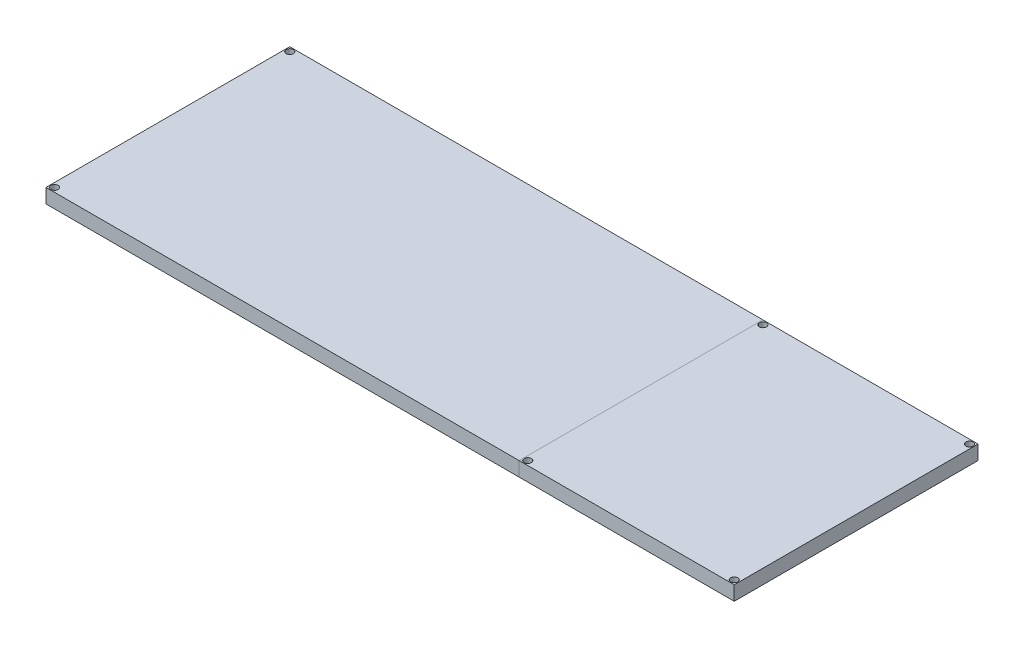
from build123d import *

# Parameters (mm, degrees)
IZIM1_W                     = 75
IZIM1_H                     = 85
Y_KSEKLIK_EKSTR_ZYON1_DEPTH = 5
IZIM2_W                     = 85
IZIM2_H                     = 5
Y_KSEKLIK_EKSTR_ZYON3_DEPTH = 165
IZIM3_R                     = 1.25
KES_EKSTR_ZYON1_DEPTH       = 186.674446276
IZIM4_R                     = 1.25
KES_EKSTR_ZYON2_DEPTH       = 186.674446276


with BuildPart() as part:
    # Çizim1 → Yükseklik-Ekstrüzyon1 (new body)
    with BuildSketch(Plane(origin=(0, 0, 0), x_dir=(1, 0, 0), z_dir=(0, 1, 0))):
        with Locations((37.5, 42.5)):
            Rectangle(IZIM1_W, IZIM1_H)
    extrude(amount=Y_KSEKLIK_EKSTR_ZYON1_DEPTH)

    # Çizim3 → Kes-Ekstrüzyon1 (cut, through all)
    with BuildSketch(Plane(origin=(0, 5, 0), x_dir=(1, 0, 0), z_dir=(0, 1, 0))):
        with Locations(Location((1.5, 1.5, 0), (0, 0, 270))):
            Circle(IZIM3_R)
        with Locations(Location((73.5, 1.5, 0), (0, 0, 270))):
            Circle(IZIM3_R)
        with Locations(Location((73.5, 83.5, 0), (0, 0, 270))):
            Circle(IZIM3_R)
        with Locations(Location((1.5, 83.5, 0), (0, 0, 270))):
            Circle(IZIM3_R)
    extrude(amount=-KES_EKSTR_ZYON1_DEPTH, mode=Mode.SUBTRACT)


with BuildPart() as body_2:
    # Çizim2 → Yükseklik-Ekstrüzyon3 (new body)
    with BuildSketch(Plane.ZY):
        with Locations((-42.5, 2.5)):
            Rectangle(IZIM2_W, IZIM2_H)
    extrude(amount=Y_KSEKLIK_EKSTR_ZYON3_DEPTH)

    # Çizim4 → Kes-Ekstrüzyon2 (cut, through all)
    with BuildSketch(Plane(origin=(0, 5, 0), x_dir=(1, 0, 0), z_dir=(0, 1, 0))):
        with Locations(Location((-163.5, 1.5, 0), (0, 0, 270))):
            Circle(IZIM4_R)
        with Locations(Location((-163.5, 83.5, 0), (0, 0, 270))):
            Circle(IZIM4_R)
    extrude(amount=-KES_EKSTR_ZYON2_DEPTH, mode=Mode.SUBTRACT)


solid = Compound([part.part, body_2.part])
